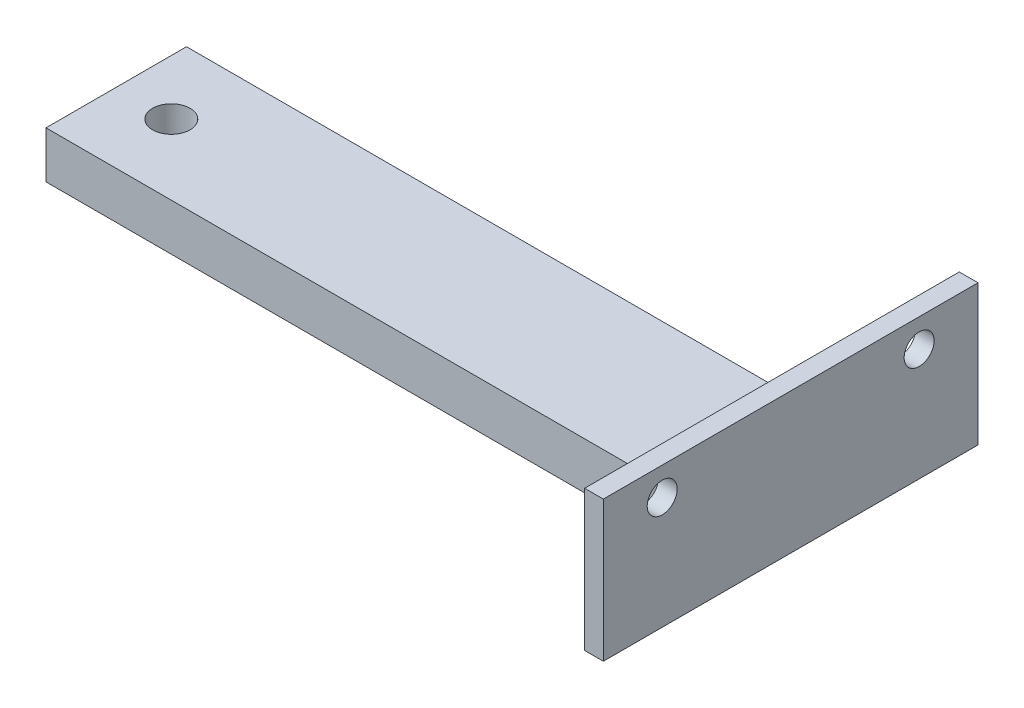
from build123d import *

# Parameters (mm, degrees)
SKETCH_3_W          = 70
SKETCH_3_H          = 5
EXTRUDE_3_DEPTH     = 15
CUT_EXTRUDE_1_REACH = 73.764
SKETCH_4_R          = 2
SKETCH_7_W          = 40
SKETCH_7_H          = 15
EXTRUDE_5_DEPTH     = 2
CUT_EXTRUDE_2_REACH = 80.147
SKETCH_9_R          = 1.6


with BuildPart() as part:
    # 草图3 → 凸台-拉伸3 (new body)
    with BuildSketch(Plane.XY):
        with Locations((35, 2.5)):
            Rectangle(SKETCH_3_W, SKETCH_3_H)
    extrude(amount=EXTRUDE_3_DEPTH)

    # 草图4 → 切除-拉伸1 (cut, up to next)
    with BuildSketch(Plane(origin=(0, 0, 0), x_dir=(1, 0, 0), z_dir=(0, 1, 0)), mode=Mode.PRIVATE) as cut_extrude_1_sk1:
        with Locations((5.878824242, -7.5)):
            Circle(SKETCH_4_R)
    cut_extrude_1_tool1 = extrude(cut_extrude_1_sk1.sketch, amount=CUT_EXTRUDE_1_REACH, mode=Mode.PRIVATE) & part.part
    add(cut_extrude_1_tool1.solids().sort_by_distance((5.878824, 0, 7.5))[0], mode=Mode.SUBTRACT)

    # 草图7 → 凸台-拉伸5 (add)
    with BuildSketch(Plane(origin=(70, 0, 0), x_dir=(0, 0, -1), z_dir=(1, 0, 0))):
        with Locations((-7.494082881, 5.421691662)):
            Rectangle(SKETCH_7_W, SKETCH_7_H)
    extrude(amount=EXTRUDE_5_DEPTH)

    # 草图9 → 切除-拉伸2 (cut, up to next)
    with BuildSketch(Plane(origin=(72, 0, 0), x_dir=(0, 0, -1), z_dir=(1, 0, 0)), mode=Mode.PRIVATE) as cut_extrude_2_sk1:
        with Locations((-21.210082881, 9.92331395)):
            Circle(SKETCH_9_R)
    cut_extrude_2_tool1 = extrude(cut_extrude_2_sk1.sketch, amount=-CUT_EXTRUDE_2_REACH, mode=Mode.PRIVATE) & part.part
    # 草图9 → 切除-拉伸2 (cut, up to next)
    with BuildSketch(Plane(origin=(72, 0, 0), x_dir=(0, 0, -1), z_dir=(1, 0, 0)), mode=Mode.PRIVATE) as cut_extrude_2_sk2:
        with Locations((6.221917119, 9.92331395)):
            Circle(SKETCH_9_R)
    cut_extrude_2_tool2 = extrude(cut_extrude_2_sk2.sketch, amount=-CUT_EXTRUDE_2_REACH, mode=Mode.PRIVATE) & part.part
    add(cut_extrude_2_tool1.solids().sort_by_distance((72, 9.923314, 21.210083))[0], mode=Mode.SUBTRACT)
    add(cut_extrude_2_tool2.solids().sort_by_distance((72, 9.923314, -6.221917))[0], mode=Mode.SUBTRACT)


solid = part.part
